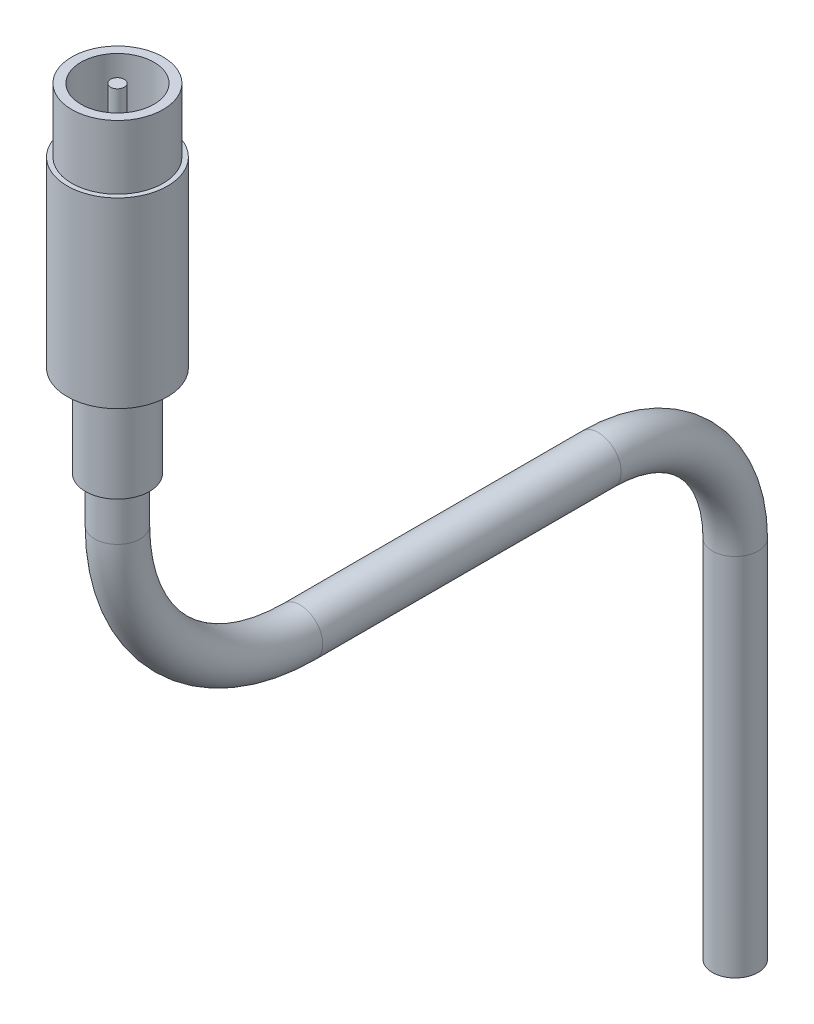
from build123d import *

# Parameters (mm, degrees)
SKETCH1_R           = 5.5
HANDLE_DEPTH        = 20
SKETCH2_R           = 5
SKETCH2_R_2         = 4
SLEEVE_DEPTH        = 7
SKETCH3_R           = 0.75
CENTRE_PIN_DEPTH    = 7
SKETCH4_R           = 3.5
STRAIN_RELIEF_DEPTH = 10
LEAD_PROFILE_R      = 2.5


with BuildPart() as part:
    # Sketch1 → Handle (new body)
    with BuildSketch(Plane(origin=(0, 0, 0), x_dir=(1, 0, 0), z_dir=(0, 1, 0))):
        with Locations(Location((0, 0, 0), (0, 0, 270))):
            Circle(SKETCH1_R)
    extrude(amount=-HANDLE_DEPTH)

    # Sketch2 → Sleeve (add)
    with BuildSketch(Plane(origin=(0, 0, 0), x_dir=(1, 0, 0), z_dir=(0, 1, 0))):
        with Locations(Location((0, 0, 0), (0, 0, 270))):
            Circle(SKETCH2_R)
        with Locations(Location((0, 0, 0), (0, 0, 270))):
            Circle(SKETCH2_R_2, mode=Mode.SUBTRACT)
    extrude(amount=SLEEVE_DEPTH)

    # Sketch3 → Centre_pin (add)
    with BuildSketch(Plane(origin=(0, 0, 0), x_dir=(1, 0, 0), z_dir=(0, 1, 0))):
        with Locations(Location((0, 0, 0), (0, 0, 270))):
            Circle(SKETCH3_R)
    extrude(amount=CENTRE_PIN_DEPTH)

    # Sketch4 → Strain_relief (add)
    with BuildSketch(Plane(origin=(0, -20, 0), x_dir=(1, 0, 0), z_dir=(0, 1, 0))):
        with Locations(Location((0, 0, 0), (0, 0, 270))):
            Circle(SKETCH4_R)
    extrude(amount=-STRAIN_RELIEF_DEPTH)

    # Lead: sweep along a path in Sketch5
    with BuildLine(Plane(origin=(0, 0, 0), x_dir=(0, 0, -1), z_dir=(1, 0, 0))) as lead_path:
        Line((0, -30), (0, -35))
        ThreePointArc((0, -35), (5.857864376, -49.142135624), (20, -55))
        Line((20, -55), (52.7, -55))
        ThreePointArc((52.7, -55), (63.306601718, -59.393398282), (67.7, -70))
        Line((67.7, -70), (67.7, -110))
    # Lead profile (on start of the path) → Lead (sweep)
    with BuildSketch(Plane(origin=(0, -30, 0), x_dir=(0, 0, -1), z_dir=(0, -1, 0))):
        Circle(LEAD_PROFILE_R)
    sweep(path=lead_path.line)


solid = part.part
